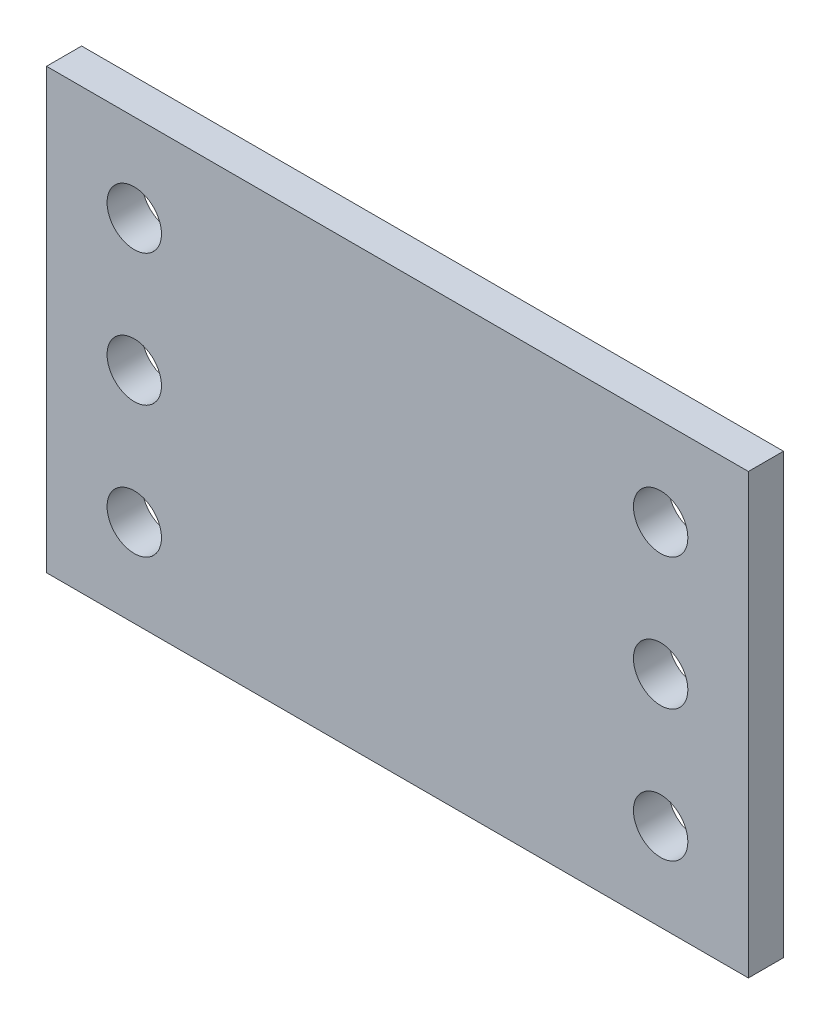
from build123d import *

# Parameters (mm, degrees)
SKETCH1_W           = 40
SKETCH1_H           = 25
BOSS_EXTRUDE1_DEPTH = 2
CUT_EXTRUDE1_REACH  = 25.67
SKETCH2_R           = 1.55


with BuildPart() as part:
    # Sketch1 → Boss-Extrude1 (new body)
    with BuildSketch(Plane.XY):
        Rectangle(SKETCH1_W, SKETCH1_H)
    extrude(amount=BOSS_EXTRUDE1_DEPTH)

    # Sketch2 → Cut-Extrude1 (cut, up to next)
    with BuildSketch(Plane.XY.offset(2), mode=Mode.PRIVATE) as cut_extrude1_sk1:
        with Locations((-15, 7.5)):
            Circle(SKETCH2_R)
    cut_extrude1_tool1 = extrude(cut_extrude1_sk1.sketch, amount=-CUT_EXTRUDE1_REACH, mode=Mode.PRIVATE) & part.part
    # Sketch2 → Cut-Extrude1 (cut, up to next)
    with BuildSketch(Plane.XY.offset(2), mode=Mode.PRIVATE) as cut_extrude1_sk2:
        with Locations((-15, 0)):
            Circle(SKETCH2_R)
    cut_extrude1_tool2 = extrude(cut_extrude1_sk2.sketch, amount=-CUT_EXTRUDE1_REACH, mode=Mode.PRIVATE) & part.part
    # Sketch2 → Cut-Extrude1 (cut, up to next)
    with BuildSketch(Plane.XY.offset(2), mode=Mode.PRIVATE) as cut_extrude1_sk3:
        with Locations((-15, -7.5)):
            Circle(SKETCH2_R)
    cut_extrude1_tool3 = extrude(cut_extrude1_sk3.sketch, amount=-CUT_EXTRUDE1_REACH, mode=Mode.PRIVATE) & part.part
    # Sketch2 → Cut-Extrude1 (cut, up to next)
    with BuildSketch(Plane.XY.offset(2), mode=Mode.PRIVATE) as cut_extrude1_sk4:
        with Locations((15, -7.5)):
            Circle(SKETCH2_R)
    cut_extrude1_tool4 = extrude(cut_extrude1_sk4.sketch, amount=-CUT_EXTRUDE1_REACH, mode=Mode.PRIVATE) & part.part
    # Sketch2 → Cut-Extrude1 (cut, up to next)
    with BuildSketch(Plane.XY.offset(2), mode=Mode.PRIVATE) as cut_extrude1_sk5:
        with Locations((15, 0)):
            Circle(SKETCH2_R)
    cut_extrude1_tool5 = extrude(cut_extrude1_sk5.sketch, amount=-CUT_EXTRUDE1_REACH, mode=Mode.PRIVATE) & part.part
    # Sketch2 → Cut-Extrude1 (cut, up to next)
    with BuildSketch(Plane.XY.offset(2), mode=Mode.PRIVATE) as cut_extrude1_sk6:
        with Locations((15, 7.5)):
            Circle(SKETCH2_R)
    cut_extrude1_tool6 = extrude(cut_extrude1_sk6.sketch, amount=-CUT_EXTRUDE1_REACH, mode=Mode.PRIVATE) & part.part
    add(cut_extrude1_tool1.solids().sort_by_distance((-15, 7.5, 2))[0], mode=Mode.SUBTRACT)
    add(cut_extrude1_tool2.solids().sort_by_distance((-15, 0, 2))[0], mode=Mode.SUBTRACT)
    add(cut_extrude1_tool3.solids().sort_by_distance((-15, -7.5, 2))[0], mode=Mode.SUBTRACT)
    add(cut_extrude1_tool4.solids().sort_by_distance((15, -7.5, 2))[0], mode=Mode.SUBTRACT)
    add(cut_extrude1_tool5.solids().sort_by_distance((15, 0, 2))[0], mode=Mode.SUBTRACT)
    add(cut_extrude1_tool6.solids().sort_by_distance((15, 7.5, 2))[0], mode=Mode.SUBTRACT)


solid = part.part
